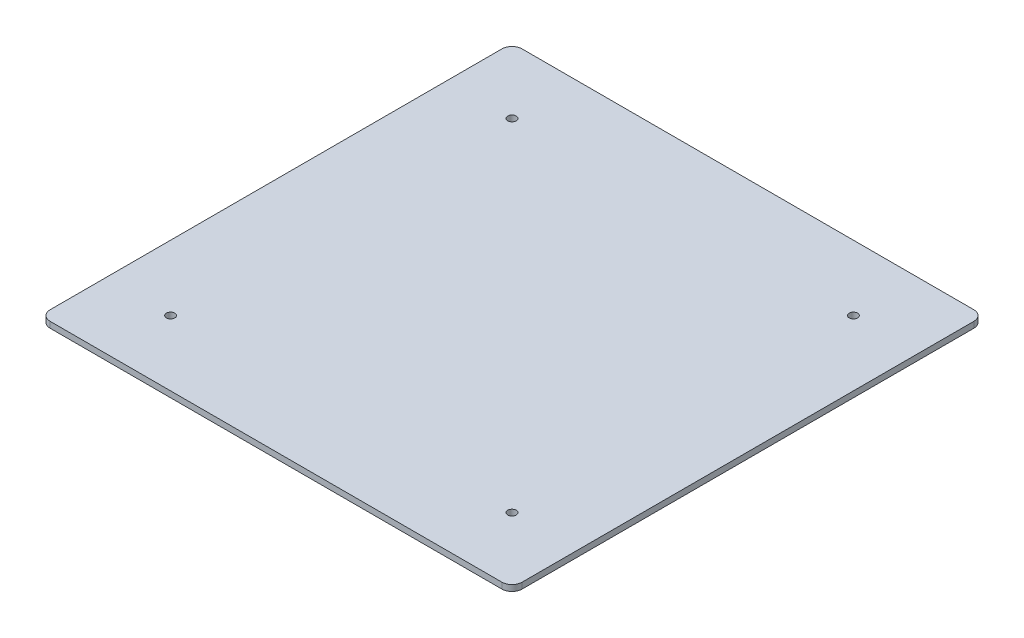
from build123d import *

# Parameters (mm, degrees)
BOSS_EXTRUDE1_DEPTH = 3
SKETCH2_R           = 2.1
CUT_EXTRUDE1_DEPTH  = 3
FILLET1_R           = 5


with BuildPart() as part:
    # Sketch1 → Boss-Extrude1 (new body)
    with BuildSketch(Plane(origin=(0, 0, 0), x_dir=(1, 0, 0), z_dir=(0, 1, 0))):
        Polygon((0, 0), (-117.5, 117.5), (-117.5, -67.83865663), align=None)
        Polygon((0, 117.5), (-117.5, 117.5), (0, 0), align=None)
        Polygon((0, 117.5), (0, 0), (117.5, -67.83865663), (117.5, 117.5), align=None)
        Polygon((117.5, -67.83865663), (0, 0), (117.5, -117.5), align=None)
        Polygon((117.5, -117.5), (0, 0), (-117.5, -67.83865663), (-117.5, -117.5), align=None)
    extrude(amount=BOSS_EXTRUDE1_DEPTH)

    # Sketch2 → Cut-Extrude1 (cut)
    with BuildSketch(Plane.XZ):
        with Locations(Location((85, -85, 0), (0, 0, 270))):
            Circle(SKETCH2_R)
        with Locations(Location((-85, 85, 0), (0, 0, 270))):
            Circle(SKETCH2_R)
        with Locations(Location((85, 85, 0), (0, 0, 270))):
            Circle(SKETCH2_R)
        with Locations(Location((-85, -85, 0), (0, 0, 270))):
            Circle(SKETCH2_R)
    extrude(amount=-CUT_EXTRUDE1_DEPTH, mode=Mode.SUBTRACT)

    # Fillet1
    fillet1_edges = [part.edges().sort_by_distance(p)[0] for p in [
        (-117.5, 1.5, 117.5),
        (-117.5, 1.5, -117.5),
        (117.5, 1.5, -117.5),
        (117.5, 1.5, 117.5),
    ]]
    fillet(fillet1_edges, radius=FILLET1_R)


solid = part.part
